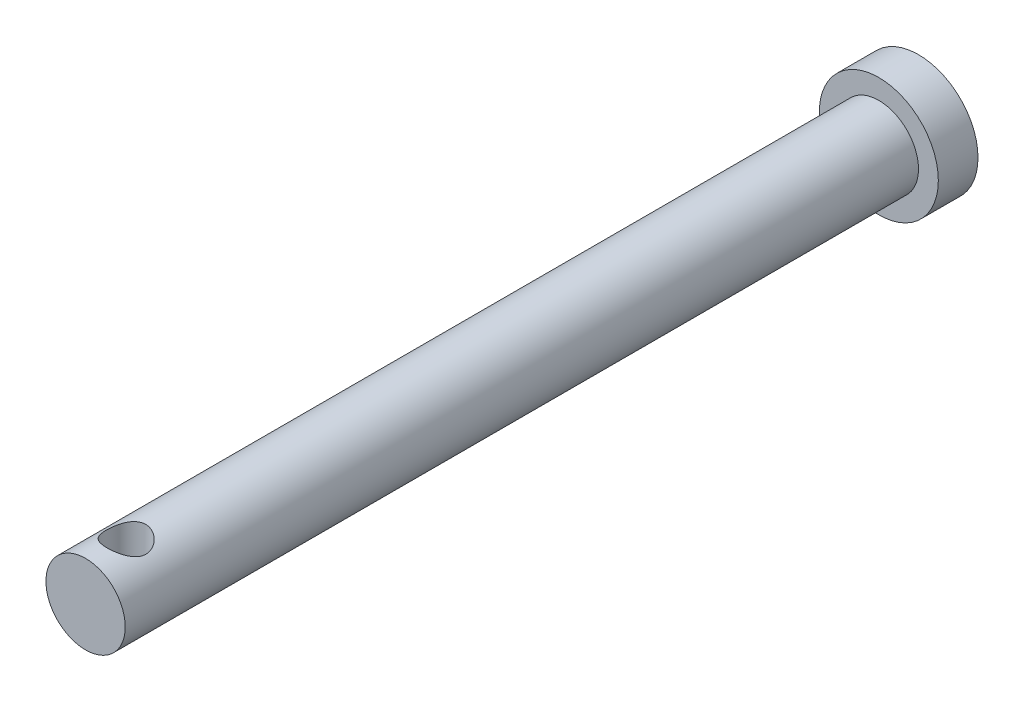
from build123d import *

# Parameters (mm, degrees)
SKETCH2_W               = 3.175
SKETCH2_H               = 6.35
SKETCH2_W_2             = 6.35
SKETCH2_H_2             = 133.35
CUT_EXTRUDE2_DEPTH      = 69.538830235
CUT_EXTRUDE2_DEPTH_BACK = 69.538830235
SKETCH5_R               = 3.175


with BuildPart() as part:
    # Sketch2 → Revolve1 (revolve)
    with BuildSketch(Plane(origin=(0, 0, 0), x_dir=(1, 0, 0), z_dir=(0, 1, 0)), mode=Mode.PRIVATE) as revolve1_sk:
        with Locations((-4.7625, 63.5)):
            Rectangle(SKETCH2_W, SKETCH2_H)
        Rectangle(SKETCH2_W_2, SKETCH2_H_2)
    revolve(revolve1_sk.sketch.rotate(Axis((3.175, 0, 66.675), (0, 0, -1)), 180), axis=Axis((3.175, 0, 66.675), (0, 0, -1)))

    # Sketch5 → Cut-Extrude2 (cut, two sides: drawn at the far end of the back side and taken through both)
    with BuildSketch(Plane(origin=(0, 0, 0), x_dir=(1, 0, 0), z_dir=(0, 1, 0)).offset(-CUT_EXTRUDE2_DEPTH_BACK)):
        with Locations(Location((3.318440536, -60.325, 0), (0, 0, 270))):
            Circle(SKETCH5_R)
    extrude(amount=CUT_EXTRUDE2_DEPTH + CUT_EXTRUDE2_DEPTH_BACK, mode=Mode.SUBTRACT)


solid = part.part
